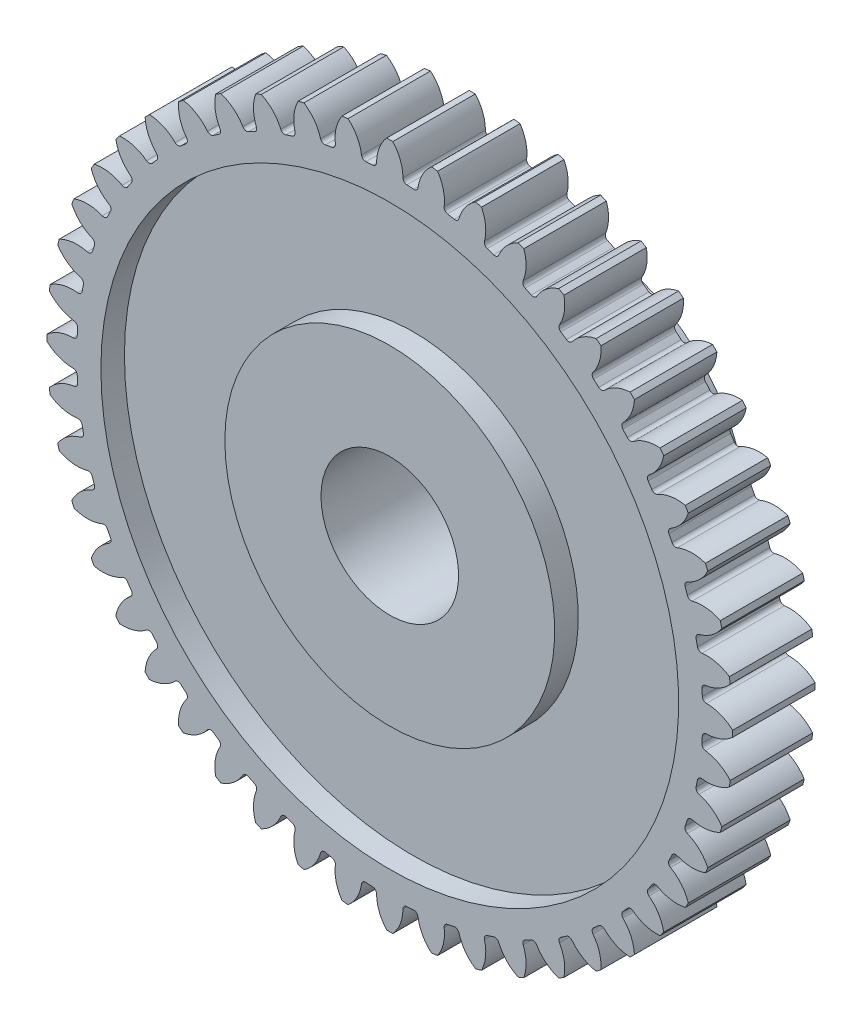
from build123d import *

# Parameters (mm, degrees)
CUT_EXTRUDE1_DEPTH = 19.971047709
CIRPATTERN1_COUNT  = 48


with BuildPart() as part:
    # Sketch3 → Revolve1 (revolve)
    with BuildSketch(Plane(origin=(0, 0, 0), x_dir=(0, 0, -1), z_dir=(1, 0, 0)), mode=Mode.PRIVATE) as revolve1_sk:
        Polygon((-3.5052, 12.46505), (-0.508, 12.46505), (-0.508, 10.5), (-1.364342857, 10.5), (-1.364342857, 5.9944), (3.5052, 5.9944), (3.5052, 2.5), (-3.5052, 2.5), (-3.5052, 5.9944), (-2.648857143, 5.9944), (-2.648857143, 10.5), (-3.5052, 10.5), align=None)
    revolve(revolve1_sk.sketch.rotate(Axis((0, 0, -3.5052), (0, 0, 1)), 90), axis=Axis((0, 0, -3.5052), (0, 0, 1)))

    # Sketch4 → Cut-Extrude1 (cut, symmetric)
    with BuildSketch(Plane.XY.offset(3.5052)):
        with BuildLine():
            ThreePointArc((-0.111291297, 12.464553171), (-0.383270284, 12.020374454), (-0.479682685, 11.508542498))
            ThreePointArc((-0.479682685, 11.508542498), (-0.520997193, 11.405837909), (-0.621504212, 11.359432521))
            ThreePointArc((-0.621504212, 11.359432521), (-0.74405359, 11.352064082), (-0.866516315, 11.343373579))
            ThreePointArc((-0.866516315, 11.343373579), (-0.972220602, 11.376263164), (-1.026587297, 11.472696476))
            ThreePointArc((-1.026587297, 11.472696476), (-1.188982353, 11.967565295), (-1.516611479, 12.37244362))
            ThreePointArc((-1.516611479, 12.37244362), (-0.815253276, 12.438361371), (-0.111291297, 12.464553171))
        make_face()
    cut_extrude1 = extrude(amount=CUT_EXTRUDE1_DEPTH, both=True, mode=Mode.SUBTRACT)

    # CirPattern1: Cut-Extrude1 ×48 about axis
    cirpattern1_axis = Axis((0, 0, 0), (0, 0, 1))
    for i in range(1, CIRPATTERN1_COUNT):
        add(cut_extrude1.rotate(cirpattern1_axis, i * 360 / CIRPATTERN1_COUNT), mode=Mode.SUBTRACT)


solid = part.part
